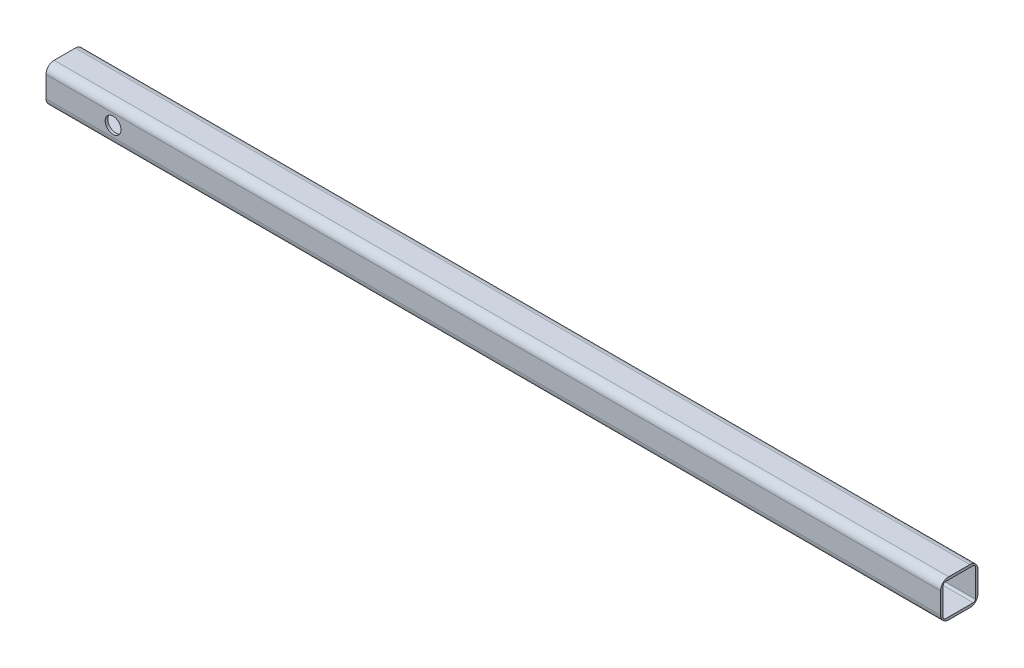
from build123d import *

# Parameters (mm, degrees)
BOSS_EXTRUDE1_DEPTH = 558.8
CUT_EXTRUDE1_REACH  = 561.776
SKETCH3_R           = 4.953


with BuildPart() as part:
    # Sketch2 → Boss-Extrude1 (new body)
    with BuildSketch(Plane(origin=(0, 0, 0), x_dir=(0, 0, -1), z_dir=(1, 0, 0))):
        with BuildLine():
            Line((5.08, 0), (18.288, 0))
            ThreePointArc((18.288, 0), (21.880102448, 1.487897552), (23.368, 5.08))
            Line((23.368, 5.08), (23.368, 18.288))
            ThreePointArc((23.368, 18.288), (21.880102448, 21.880102448), (18.288, 23.368))
            Line((18.288, 23.368), (5.08, 23.368))
            ThreePointArc((5.08, 23.368), (1.487897552, 21.880102448), (0, 18.288))
            Line((0, 18.288), (0, 5.08))
            ThreePointArc((0, 5.08), (1.487897552, 1.487897552), (5.08, 0))
        make_face()
        with BuildLine():
            Line((2.921, 1.651), (20.447, 1.651))
            ThreePointArc((20.447, 1.651), (21.345025612, 2.022974388), (21.717, 2.921))
            Line((21.717, 2.921), (21.717, 20.447))
            ThreePointArc((21.717, 20.447), (21.345025612, 21.345025612), (20.447, 21.717))
            Line((20.447, 21.717), (2.921, 21.717))
            ThreePointArc((2.921, 21.717), (2.022974388, 21.345025612), (1.651, 20.447))
            Line((1.651, 20.447), (1.651, 2.921))
            ThreePointArc((1.651, 2.921), (2.022974388, 2.022974388), (2.921, 1.651))
        make_face(mode=Mode.SUBTRACT)
    extrude(amount=BOSS_EXTRUDE1_DEPTH)

    # Cut-Extrude1: up to this face of the body (flat: up to its plane)
    cut_extrude1_end = Plane(part.part.faces().sort_by_distance((279.4, 11.684, -23.368))[0])
    # Sketch3 → Cut-Extrude1 (cut, up to the picked face)
    with BuildSketch(Plane.XY, mode=Mode.PRIVATE) as cut_extrude1_sk1:
        with Locations((41.91, 11.684)):
            Circle(SKETCH3_R)
    cut_extrude1_tool1 = split(extrude(cut_extrude1_sk1.sketch, amount=-CUT_EXTRUDE1_REACH, mode=Mode.PRIVATE), bisect_by=cut_extrude1_end, keep=Keep.BOTH, mode=Mode.PRIVATE)
    add(cut_extrude1_tool1.solids().sort_by(Axis((41.91, 11.684, 0), (0, 0, -1)))[0], mode=Mode.SUBTRACT)


solid = part.part
